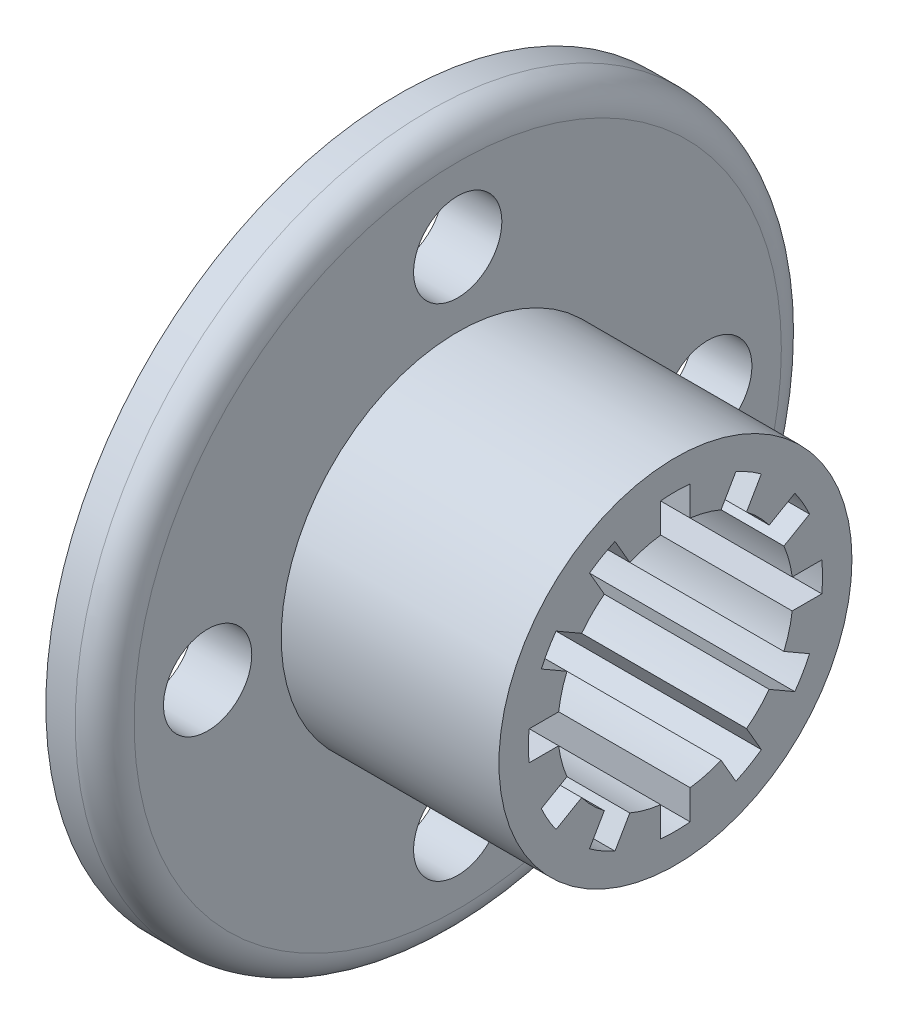
from build123d import *

# Parameters (mm, degrees)
SKETCH1_R           = 6
BOSS_EXTRUDE1_DEPTH = 1
FILLET2_R           = 0.5
SKETCH3_R           = 3
SKETCH3_R_2         = 2.5
BOSS_EXTRUDE2_DEPTH = 3.7
SKETCH4_R           = 2.5
CUT_EXTRUDE1_DEPTH  = 10.256889391
BOSS_EXTRUDE3_DEPTH = 3.7
SKETCH6_R           = 0.75
CUT_EXTRUDE2_DEPTH  = 10.256889391


with BuildPart() as part:
    # Sketch1 → Boss-Extrude1 (new body)
    with BuildSketch(Plane(origin=(0, 0, 0), x_dir=(0, 0, -1), z_dir=(1, 0, 0))):
        Circle(SKETCH1_R)
    extrude(amount=BOSS_EXTRUDE1_DEPTH)

    # Fillet2
    fillet2_edges = [part.edges().sort_by_distance(p)[0] for p in [
        (1, 0, 6),
    ]]
    fillet(fillet2_edges, radius=FILLET2_R)

    # Sketch3 → Boss-Extrude2 (add)
    with BuildSketch(Plane(origin=(1, 0, 0), x_dir=(0, 0, -1), z_dir=(1, 0, 0))):
        Circle(SKETCH3_R)
        Circle(SKETCH3_R_2, mode=Mode.SUBTRACT)
    extrude(amount=BOSS_EXTRUDE2_DEPTH)

    # Sketch4 → Cut-Extrude1 (cut, through all)
    with BuildSketch(Plane(origin=(1, 0, 0), x_dir=(0, 0, -1), z_dir=(1, 0, 0))):
        Circle(SKETCH4_R)
    extrude(amount=-CUT_EXTRUDE1_DEPTH, mode=Mode.SUBTRACT)

    # Sketch5 → Boss-Extrude3 (add, through all)
    with BuildSketch(Plane(origin=(1, 0, 0), x_dir=(0, 0, -1), z_dir=(1, 0, 0))):
        with BuildLine():
            Line((-2.537715508, 0.25), (-1.984313483, 0.25))
            ThreePointArc((-1.984313483, 0.25), (-1.931851653, 0.51763809), (-1.843465886, 0.775650391))
            Line((-1.843465886, 0.775650391), (-2.322726098, 1.052351403))
            ThreePointArc((-2.322726098, 1.052351403), (-2.463110857, 0.659988565), (-2.537715508, 0.25))
        make_face()
        with BuildLine():
            Line((-2.537715508, -0.25), (-1.984313483, -0.25))
            ThreePointArc((-1.984313483, -0.25), (-1.931851653, -0.51763809), (-1.843465886, -0.775650391))
            Line((-1.843465886, -0.775650391), (-2.322726098, -1.052351403))
            ThreePointArc((-2.322726098, -1.052351403), (-2.463110857, -0.659988565), (-2.537715508, -0.25))
        make_face()
        with BuildLine():
            Line((-2.072726098, 1.485364105), (-1.593465886, 1.208663093))
            ThreePointArc((-1.593465886, 1.208663093), (-1.414213562, 1.414213562), (-1.208663093, 1.593465886))
            Line((-1.208663093, 1.593465886), (-1.485364105, 2.072726098))
            ThreePointArc((-1.485364105, 2.072726098), (-1.803122292, 1.803122292), (-2.072726098, 1.485364105))
        make_face()
        with BuildLine():
            Line((-1.052351403, 2.322726098), (-0.775650391, 1.843465886))
            ThreePointArc((-0.775650391, 1.843465886), (-0.51763809, 1.931851653), (-0.25, 1.984313483))
            Line((-0.25, 1.984313483), (-0.25, 2.537715508))
            ThreePointArc((-0.25, 2.537715508), (-0.659988565, 2.463110857), (-1.052351403, 2.322726098))
        make_face()
        with BuildLine():
            Line((0.25, 2.537715508), (0.25, 1.984313483))
            ThreePointArc((0.25, 1.984313483), (0.51763809, 1.931851653), (0.775650391, 1.843465886))
            Line((0.775650391, 1.843465886), (1.052351403, 2.322726098))
            ThreePointArc((1.052351403, 2.322726098), (0.659988565, 2.463110857), (0.25, 2.537715508))
        make_face()
        with BuildLine():
            Line((1.485364105, 2.072726098), (1.208663093, 1.593465886))
            ThreePointArc((1.208663093, 1.593465886), (1.414213562, 1.414213562), (1.593465886, 1.208663093))
            Line((1.593465886, 1.208663093), (2.072726098, 1.485364105))
            ThreePointArc((2.072726098, 1.485364105), (1.803122292, 1.803122292), (1.485364105, 2.072726098))
        make_face()
        with BuildLine():
            Line((2.322726098, 1.052351403), (1.843465886, 0.775650391))
            ThreePointArc((1.843465886, 0.775650391), (1.931851653, 0.51763809), (1.984313483, 0.25))
            Line((1.984313483, 0.25), (2.537715508, 0.25))
            ThreePointArc((2.537715508, 0.25), (2.463110857, 0.659988565), (2.322726098, 1.052351403))
        make_face()
        with BuildLine():
            Line((2.537715508, -0.25), (1.984313483, -0.25))
            ThreePointArc((1.984313483, -0.25), (1.931851653, -0.51763809), (1.843465886, -0.775650391))
            Line((1.843465886, -0.775650391), (2.322726098, -1.052351403))
            ThreePointArc((2.322726098, -1.052351403), (2.463110857, -0.659988565), (2.537715508, -0.25))
        make_face()
        with BuildLine():
            Line((2.072726098, -1.485364105), (1.593465886, -1.208663093))
            ThreePointArc((1.593465886, -1.208663093), (1.414213562, -1.414213562), (1.208663093, -1.593465886))
            Line((1.208663093, -1.593465886), (1.485364105, -2.072726098))
            ThreePointArc((1.485364105, -2.072726098), (1.803122292, -1.803122292), (2.072726098, -1.485364105))
        make_face()
        with BuildLine():
            Line((1.052351403, -2.322726098), (0.775650391, -1.843465886))
            ThreePointArc((0.775650391, -1.843465886), (0.51763809, -1.931851653), (0.25, -1.984313483))
            Line((0.25, -1.984313483), (0.25, -2.537715508))
            ThreePointArc((0.25, -2.537715508), (0.659988565, -2.463110857), (1.052351403, -2.322726098))
        make_face()
        with BuildLine():
            Line((-0.25, -2.537715508), (-0.25, -1.984313483))
            ThreePointArc((-0.25, -1.984313483), (-0.51763809, -1.931851653), (-0.775650391, -1.843465886))
            Line((-0.775650391, -1.843465886), (-1.052351403, -2.322726098))
            ThreePointArc((-1.052351403, -2.322726098), (-0.659988565, -2.463110857), (-0.25, -2.537715508))
        make_face()
        with BuildLine():
            Line((-1.485364105, -2.072726098), (-1.208663093, -1.593465886))
            ThreePointArc((-1.208663093, -1.593465886), (-1.414213562, -1.414213562), (-1.593465886, -1.208663093))
            Line((-1.593465886, -1.208663093), (-2.072726098, -1.485364105))
            ThreePointArc((-2.072726098, -1.485364105), (-1.803122292, -1.803122292), (-1.485364105, -2.072726098))
        make_face()
    extrude(amount=BOSS_EXTRUDE3_DEPTH)

    # Sketch6 → Cut-Extrude2 (cut, through all)
    with BuildSketch(Plane(origin=(1, 0, 0), x_dir=(0, 0, -1), z_dir=(1, 0, 0))):
        with Locations((-4.25, 0)):
            Circle(SKETCH6_R)
        with Locations((0, 4.25)):
            Circle(SKETCH6_R)
        with Locations((4.25, 0)):
            Circle(SKETCH6_R)
        with Locations((0, -4.25)):
            Circle(SKETCH6_R)
    extrude(amount=-CUT_EXTRUDE2_DEPTH, mode=Mode.SUBTRACT)


solid = part.part
